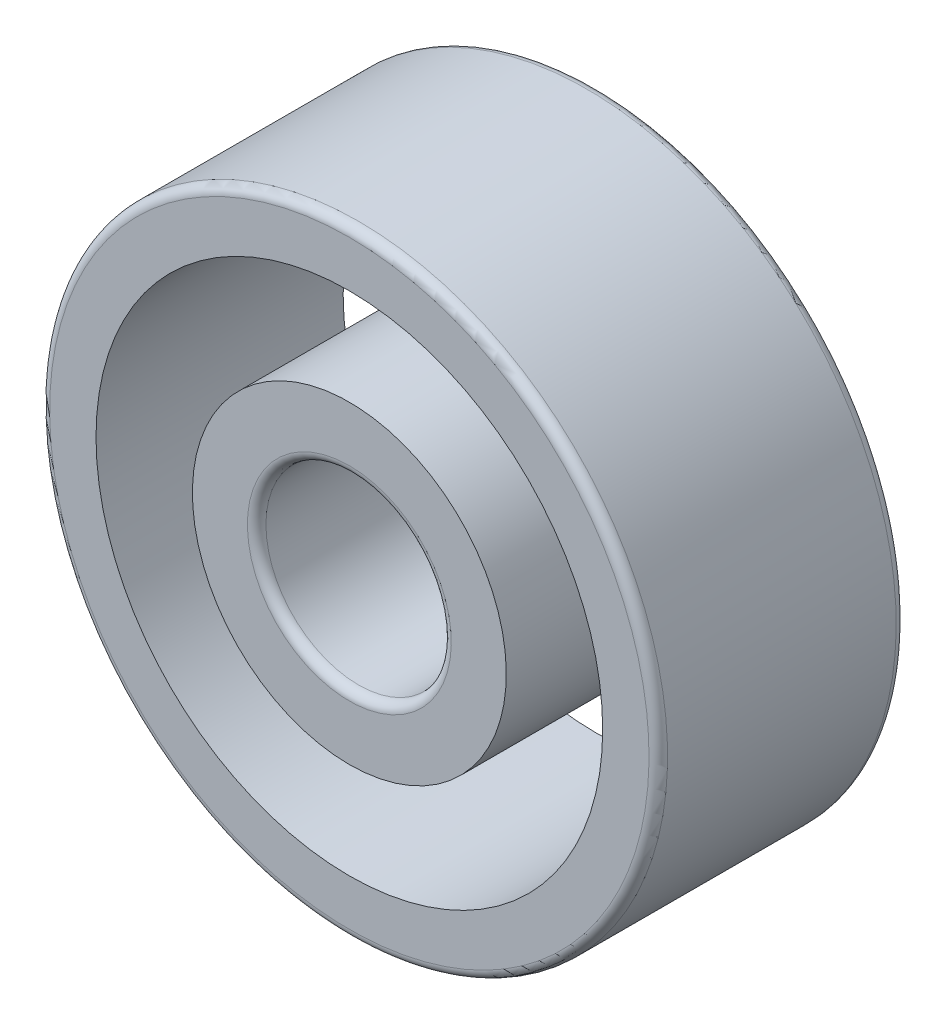
from build123d import *

# Parameters (mm, degrees)
SKETCH1_W   = 4
SKETCH1_H   = 0.9
SKETCH1_H_2 = 1.04
FILLET1_R   = 0.15
FILLET2_R   = 0.15


with BuildPart() as part:
    # Sketch1 → Revolve1 (revolve)
    with BuildSketch(Plane(origin=(0, 0, 0), x_dir=(0, 0, -1), z_dir=(1, 0, 0)), mode=Mode.PRIVATE) as revolve1_sk:
        with Locations((0, 4.55)):
            Rectangle(SKETCH1_W, SKETCH1_H)
        with Locations((0, 2.02)):
            Rectangle(SKETCH1_W, SKETCH1_H_2)
    revolve(revolve1_sk.sketch.rotate(Axis((0, 0, 2), (0, 0, -1)), 180), axis=Axis((0, 0, 2), (0, 0, -1)))

    # Fillet1
    fillet1_edges = [part.edges().sort_by_distance(p)[0] for p in [
        (0, 5, 2),
        (0, 5, -2),
    ]]
    fillet(fillet1_edges, radius=FILLET1_R)

    # Fillet2
    fillet2_edges = [part.edges().sort_by_distance(p)[0] for p in [
        (0, 1.5, -2),
        (0, 1.5, 2),
    ]]
    fillet(fillet2_edges, radius=FILLET2_R)


solid = part.part
